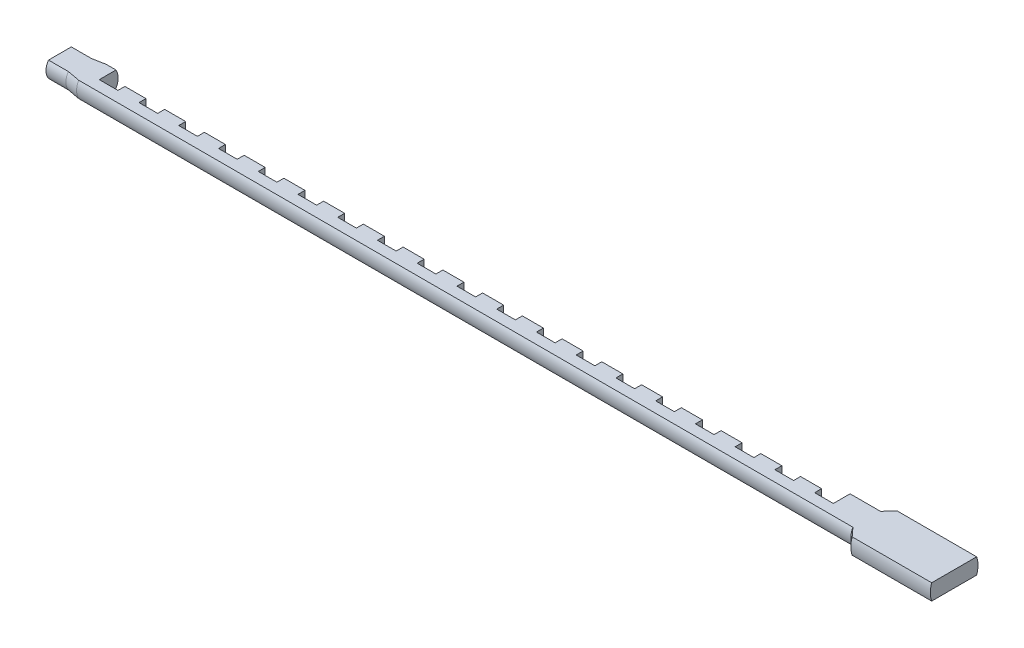
from build123d import *

# Parameters (mm, degrees)
CUT_EXTRUDE1_DEPTH      = 126.287668986
CUT_EXTRUDE1_DEPTH_BACK = 126.287668986
SKETCH3_W               = 4.7
SKETCH3_H               = 4.75
CUT_EXTRUDE2_DEPTH      = 126.287668986
CUT_EXTRUDE2_DEPTH_BACK = 126.287668986
SKETCH4_W               = 184.7
SKETCH4_H               = 3
CUT_EXTRUDE4_DEPTH      = 226.159943152
CUT_EXTRUDE4_DEPTH_BACK = 226.159943152
SKETCH5_W               = 15.463728056
SKETCH5_H               = 5.091329687
SKETCH5_H_2             = 5.301676888


with BuildPart() as part:
    # Sketch1 → Revolve1 (revolve)
    with BuildSketch(Plane(origin=(0, 0, 0), x_dir=(1, 0, 0), z_dir=(0, 1, 0)), mode=Mode.PRIVATE) as revolve1_sk:
        Polygon((-125, 0), (-125, 3.5), (-120, 3.5), (-116.802652106, 4), (78, 4), (80, 6), (100, 6), (100, 0), align=None)
    revolve(revolve1_sk.sketch.rotate(Axis((-125, 0, 0), (1, 0, 0)), 180), axis=Axis((-125, 0, 0), (1, 0, 0)))

    # Sketch3 → Cut-Extrude1 (cut, two sides: drawn at the far end of the back side and taken through both)
    with BuildSketch(Plane(origin=(0, 0, 0), x_dir=(1, 0, 0), z_dir=(0, 1, 0)).offset(-CUT_EXTRUDE1_DEPTH_BACK)):
        with Locations((-112, 1.625)):
            Rectangle(SKETCH3_W, SKETCH3_H)
        with Locations((-102, 1.625)):
            Rectangle(SKETCH3_W, SKETCH3_H)
        with Locations((-92, 1.625)):
            Rectangle(SKETCH3_W, SKETCH3_H)
        with Locations((-82, 1.625)):
            Rectangle(SKETCH3_W, SKETCH3_H)
        with Locations((-72, 1.625)):
            Rectangle(SKETCH3_W, SKETCH3_H)
        with Locations((-62, 1.625)):
            Rectangle(SKETCH3_W, SKETCH3_H)
        with Locations((-52, 1.625)):
            Rectangle(SKETCH3_W, SKETCH3_H)
        with Locations((-42, 1.625)):
            Rectangle(SKETCH3_W, SKETCH3_H)
        with Locations((-32, 1.625)):
            Rectangle(SKETCH3_W, SKETCH3_H)
        with Locations((-22, 1.625)):
            Rectangle(SKETCH3_W, SKETCH3_H)
        with Locations((-12, 1.625)):
            Rectangle(SKETCH3_W, SKETCH3_H)
        with Locations((-2, 1.625)):
            Rectangle(SKETCH3_W, SKETCH3_H)
        with Locations((8, 1.625)):
            Rectangle(SKETCH3_W, SKETCH3_H)
        with Locations((18, 1.625)):
            Rectangle(SKETCH3_W, SKETCH3_H)
        with Locations((28, 1.625)):
            Rectangle(SKETCH3_W, SKETCH3_H)
        with Locations((38, 1.625)):
            Rectangle(SKETCH3_W, SKETCH3_H)
        with Locations((48, 1.625)):
            Rectangle(SKETCH3_W, SKETCH3_H)
        with Locations((58, 1.625)):
            Rectangle(SKETCH3_W, SKETCH3_H)
        with Locations((68, 1.625)):
            Rectangle(SKETCH3_W, SKETCH3_H)
    extrude(amount=CUT_EXTRUDE1_DEPTH + CUT_EXTRUDE1_DEPTH_BACK, mode=Mode.SUBTRACT)

    # Sketch4 → Cut-Extrude2 (cut, two sides: drawn at the far end of the back side and taken through both)
    with BuildSketch(Plane(origin=(0, 0, 0), x_dir=(1, 0, 0), z_dir=(0, 1, 0)).offset(-CUT_EXTRUDE2_DEPTH_BACK)):
        with Locations((-22, 2.5)):
            Rectangle(SKETCH4_W, SKETCH4_H)
    extrude(amount=CUT_EXTRUDE2_DEPTH + CUT_EXTRUDE2_DEPTH_BACK, mode=Mode.SUBTRACT)

    # Sketch5 → Cut-Extrude4 (cut, two sides: drawn at the far end of the back side and taken through both)
    with BuildSketch(Plane.ZY.offset(125).offset(-CUT_EXTRUDE4_DEPTH_BACK)):
        with Locations((0.057906168, -4.545664844)):
            Rectangle(SKETCH5_W, SKETCH5_H)
        with Locations((0.057906168, 4.650838444)):
            Rectangle(SKETCH5_W, SKETCH5_H_2)
    extrude(amount=CUT_EXTRUDE4_DEPTH + CUT_EXTRUDE4_DEPTH_BACK, mode=Mode.SUBTRACT)


solid = part.part
